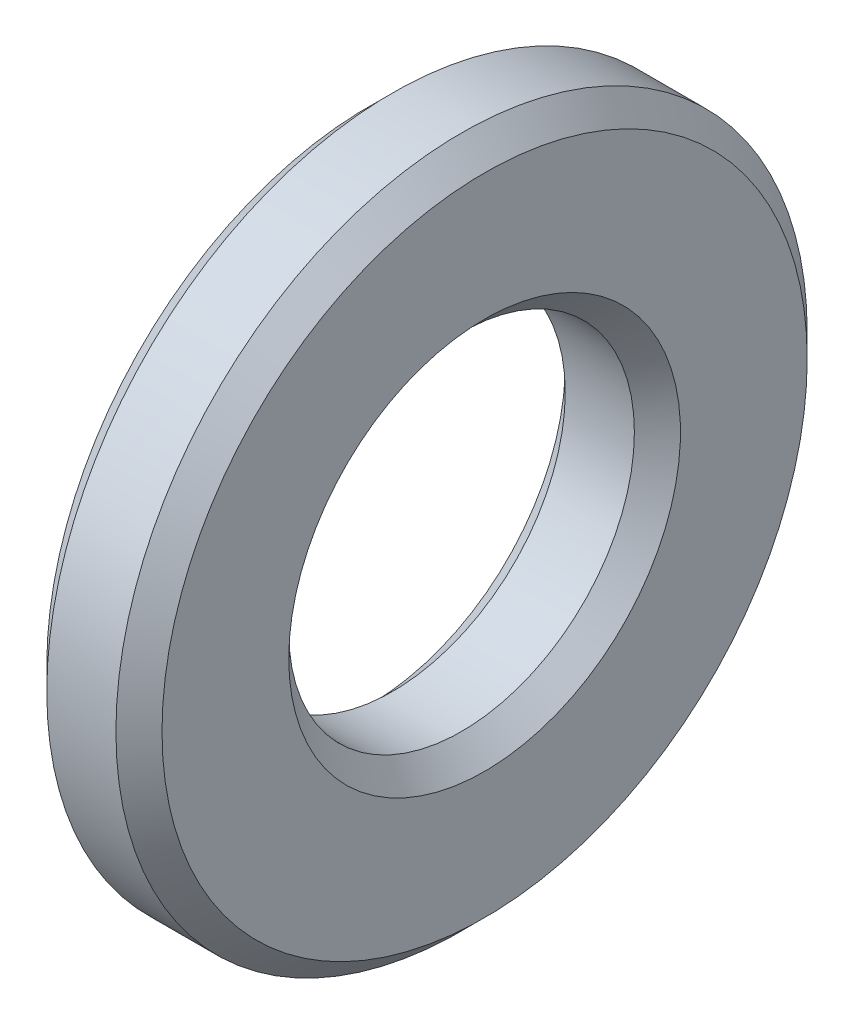
from build123d import *


with BuildPart() as part:
    # Sketch1 → Revolve1 (revolve)
    with BuildSketch(Plane.XY):
        Polygon((0.2, 3), (0.8, 3), (1, 2.8), (1, 1.7), (0.8, 1.5), (0.2, 1.5), (0, 1.7), (0, 2.8), align=None)
    revolve(axis=Axis((-0.05, 0, 0), (1, 0, 0)))


solid = part.part
